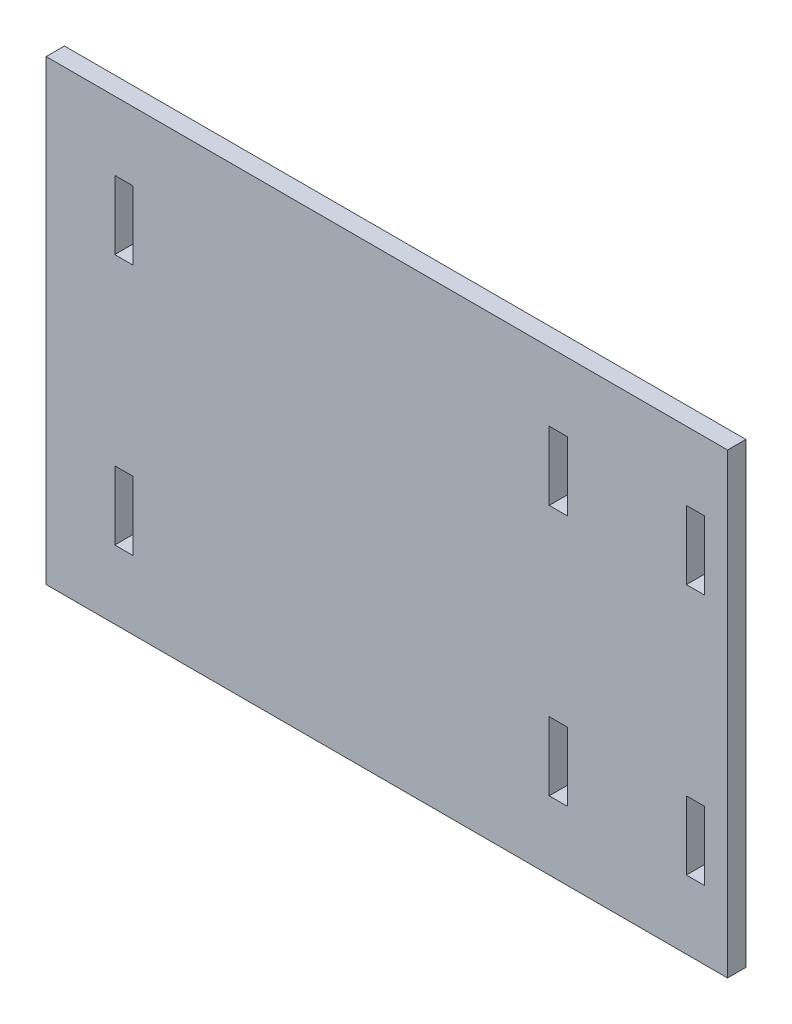
from build123d import *

# Parameters (mm, degrees)
SKETCH1_W           = 4
SKETCH1_H           = 15
BOSS_EXTRUDE1_DEPTH = 4


with BuildPart() as part:
    # Sketch1 → Boss-Extrude1 (new body)
    with BuildSketch(Plane.XY):
        Polygon((-64.5, -50), (64.5, -50), (84.5, -50), (84.5, 50), (64.5, 50), (-64.5, 50), align=None)
        with Locations((47.5, 27.5)):
            Rectangle(SKETCH1_W, SKETCH1_H, mode=Mode.SUBTRACT)
        with Locations((47.5, -27.5)):
            Rectangle(SKETCH1_W, SKETCH1_H, mode=Mode.SUBTRACT)
        with Locations((-47.5, 27.5)):
            Rectangle(SKETCH1_W, SKETCH1_H, mode=Mode.SUBTRACT)
        with Locations((-47.5, -27.5)):
            Rectangle(SKETCH1_W, SKETCH1_H, mode=Mode.SUBTRACT)
        with Locations((77.5, 27.5)):
            Rectangle(SKETCH1_W, SKETCH1_H, mode=Mode.SUBTRACT)
        with Locations((77.5, -27.5)):
            Rectangle(SKETCH1_W, SKETCH1_H, mode=Mode.SUBTRACT)
    extrude(amount=BOSS_EXTRUDE1_DEPTH)


solid = part.part
